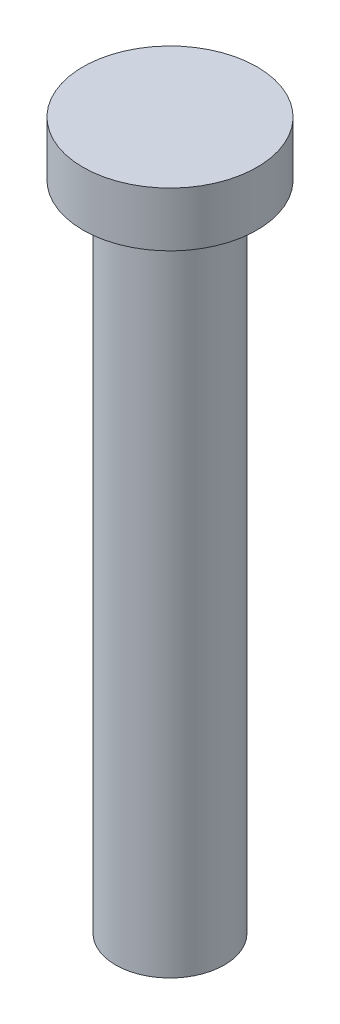
from build123d import *

# Parameters (mm, degrees)
SKETCH1_R           = 2.5
BOSS_EXTRUDE1_DEPTH = 30
SKETCH2_R           = 4
BOSS_EXTRUDE2_DEPTH = 2.5
CHAMFER1_SIZE       = 1


with BuildPart() as part:
    # Sketch1 → Boss-Extrude1 (new body)
    with BuildSketch(Plane(origin=(0, 0, 0), x_dir=(1, 0, 0), z_dir=(0, 1, 0))):
        with Locations(Location((0, 0, 0), (0, 0, 270))):
            Circle(SKETCH1_R)
    extrude(amount=BOSS_EXTRUDE1_DEPTH)

    # Sketch2 → Boss-Extrude2 (add)
    with BuildSketch(Plane(origin=(0, 30, 0), x_dir=(1, 0, 0), z_dir=(0, 1, 0))):
        with Locations(Location((0, 0, 0), (0, 0, 270))):
            Circle(SKETCH2_R)
    extrude(amount=BOSS_EXTRUDE2_DEPTH)

    # Chamfer1
    chamfer1_edges = [part.edges().sort_by_distance(p)[0] for p in [
        (0, 30, -2.5),
    ]]
    chamfer(chamfer1_edges, length=CHAMFER1_SIZE)


solid = part.part
